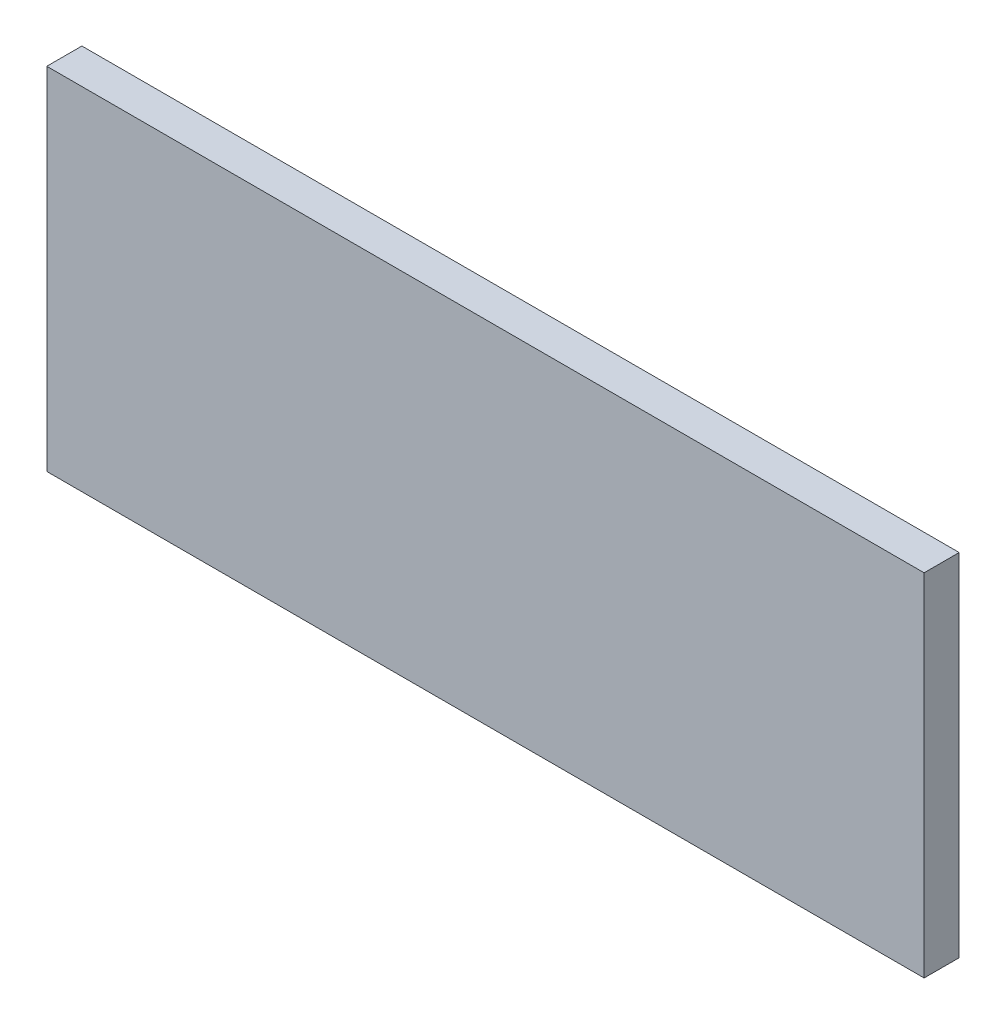
from build123d import *

# Parameters (mm, degrees)
SKETCH_1_W      = 50
SKETCH_1_H      = 20
EXTRUDE_1_DEPTH = 2


with BuildPart() as part:
    # 草图1 → 凸台-拉伸1 (new body)
    with BuildSketch(Plane.XY):
        Rectangle(SKETCH_1_W, SKETCH_1_H)
    extrude(amount=EXTRUDE_1_DEPTH)


solid = part.part
